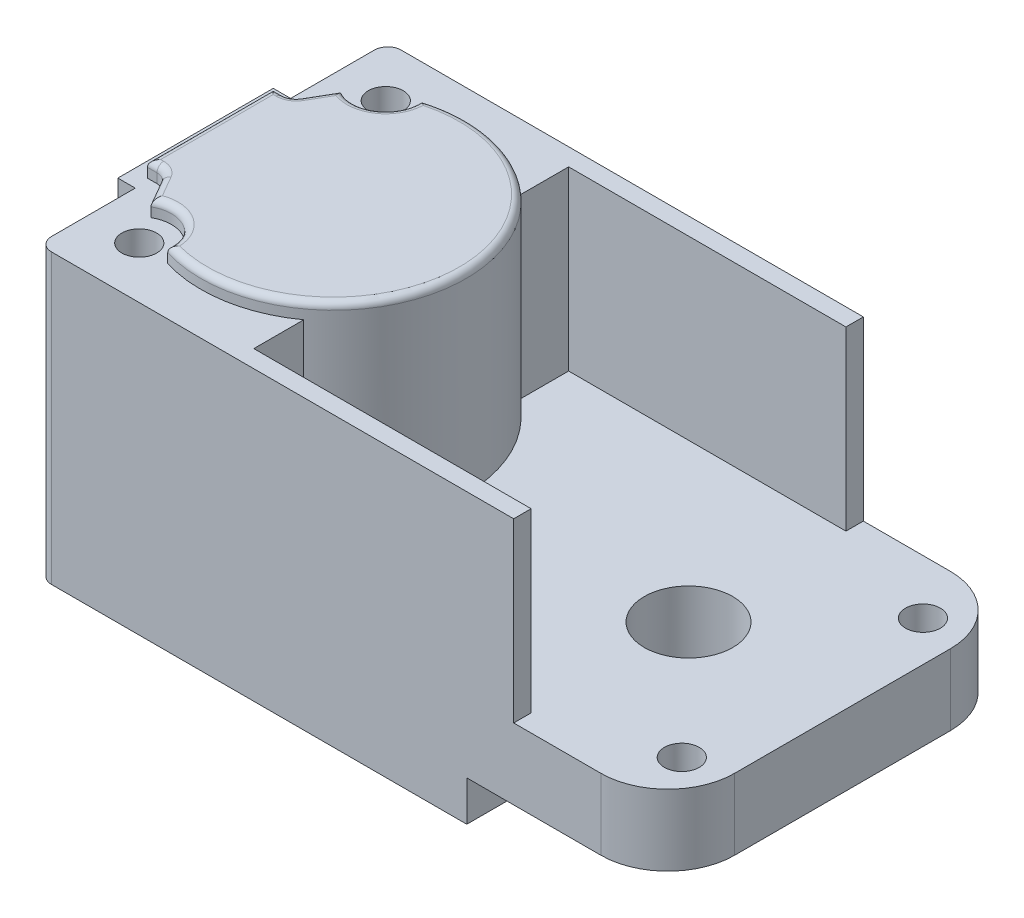
from build123d import *

# Parameters (mm, degrees)
SKETCH1_R          = 1.3
EXTRUDE1_DEPTH     = 21.5
EXTRUDE2_DEPTH     = 1.2
FILLET1_R          = 0.5
SKETCH4_W          = 11.5
SKETCH4_H          = 26.1
CUT_EXTRUDE2_DEPTH = 13.2
CUT_EXTRUDE3_DEPTH = 3
CUT_EXTRUDE4_START = -13.2
CUT_EXTRUDE4_DEPTH = 13.2
SKETCH6_R          = 3.3
CUT_EXTRUDE5_DEPTH = 46.164504919


with BuildPart() as part:
    # Sketch1 → Extrude1 (new body)
    with BuildSketch(Plane(origin=(0, 0, 0), x_dir=(1, 0, 0), z_dir=(0, 1, 0))):
        with BuildLine():
            Line((-34.5, 13.05), (6.5, 13.05))
            ThreePointArc((6.5, 13.05), (10.035533906, 11.585533906), (11.5, 8.05))
            Line((11.5, 8.05), (11.5, -8.05))
            ThreePointArc((11.5, -8.05), (10.035533906, -11.585533906), (6.5, -13.05))
            Line((6.5, -13.05), (-34.5, -13.05))
            ThreePointArc((-34.5, -13.05), (-35.207106781, -12.757106781), (-35.5, -12.05))
            Line((-35.5, -12.05), (-35.5, -5.8))
            Line((-35.5, -5.8), (-36.8, -5.8))
            Line((-36.8, -5.8), (-36.8, 5.8))
            Line((-36.8, 5.8), (-35.5, 5.8))
            Line((-35.5, 5.8), (-35.5, 12.05))
            ThreePointArc((-35.5, 12.05), (-35.207106781, 12.757106781), (-34.5, 13.05))
        make_face()
        with Locations(Location((-31.8, 9.2, 0), (0, 0, 270))):
            Circle(SKETCH1_R, mode=Mode.SUBTRACT)
        with Locations(Location((8.5, 9, 0), (0, 0, 270))):
            Circle(SKETCH1_R, mode=Mode.SUBTRACT)
        with Locations(Location((8.5, -9, 0), (0, 0, 90))):
            Circle(SKETCH1_R, mode=Mode.SUBTRACT)
        with Locations(Location((-31.8, -9.2, 0), (0, 0, 90))):
            Circle(SKETCH1_R, mode=Mode.SUBTRACT)
    extrude(amount=EXTRUDE1_DEPTH)

    # Sketch2 → Extrude2 (add)
    with BuildSketch(Plane(origin=(0, 21.5, 0), x_dir=(-1, 0, 0), z_dir=(0, 1, 0))):
        with BuildLine():
            Line((33.000666235, -7.121923824), (34.111271501, -5.199722402))
            ThreePointArc((34.111271501, -5.199722402), (34.477275392, -4.833894464), (34.977136574, -4.7))
            Line((34.977136574, -4.7), (35.7, -4.7))
            Line((35.7, -4.7), (35.7, 4.7))
            Line((35.7, 4.7), (34.977136574, 4.7))
            ThreePointArc((34.977136574, 4.7), (34.477275392, 4.833894464), (34.111271501, 5.199722402))
            Line((34.111271501, 5.199722402), (33.000666235, 7.121923824))
            ThreePointArc((33.000666235, 7.121923824), (30.488773811, 7.189854264), (29.414271687, 9.461343485))
            ThreePointArc((29.414271687, 9.461343485), (16.6, 0), (29.414271687, -9.461343485))
            ThreePointArc((29.414271687, -9.461343485), (30.488773811, -7.189854264), (33.000666235, -7.121923824))
        make_face()
    extrude(amount=EXTRUDE2_DEPTH)

    # Fillet1
    fillet1_edges = [part.edges().sort_by_distance(p)[0] for p in [
        (-30.488773811, 22.7, 7.189854264),
        (-16.6, 22.7, 0),
        (-30.488773811, 22.7, -7.189854264),
        (-33.555968868, 22.7, -6.160823113),
        (-34.477275392, 22.7, -4.833894464),
        (-35.338568287, 22.7, -4.7),
        (-35.7, 22.7, 0),
        (-35.338568287, 22.7, 4.7),
        (-34.477275392, 22.7, 4.833894464),
        (-33.555968868, 22.7, 6.160823113),
    ]]
    fillet(fillet1_edges, radius=FILLET1_R)

    # Sketch4 → Cut-Extrude2 (cut)
    with BuildSketch(Plane(origin=(0, 21.5, 0), x_dir=(-1, 0, 0), z_dir=(0, 1, 0))):
        with Locations((-5.75, 0)):
            Rectangle(SKETCH4_W, SKETCH4_H)
    extrude(amount=-CUT_EXTRUDE2_DEPTH, mode=Mode.SUBTRACT)

    # Sketch5 → Cut-Extrude3 (cut)
    with BuildSketch(Plane.XZ):
        with BuildLine():
            Line((-3.5, -13.05), (-3.5, 13.05))
            Line((-3.5, 13.05), (6.5, 13.05))
            ThreePointArc((6.5, 13.05), (10.035533906, 11.585533906), (11.5, 8.05))
            Line((11.5, 8.05), (11.5, -8.05))
            ThreePointArc((11.5, -8.05), (10.035533906, -11.585533906), (6.5, -13.05))
            Line((6.5, -13.05), (-3.5, -13.05))
        make_face()
    extrude(amount=-CUT_EXTRUDE3_DEPTH, mode=Mode.SUBTRACT)

    # Sketch3 → Cut-Extrude4 (cut)
    with BuildSketch(Plane(origin=(0, 21.5, 0), x_dir=(-1, 0, 0), z_dir=(0, 1, 0)).offset(CUT_EXTRUDE4_START)):
        with BuildLine():
            Line((20.7, 8.023091673), (20.7, 11.75))
            Line((20.7, 11.75), (-6.5, 11.75))
            ThreePointArc((-6.5, 11.75), (-7.422418806, 11.633175065), (-8.286588144, 11.290077592))
            ThreePointArc((-8.286588144, 11.290077592), (-6.441484419, 7.974079144), (-10.2, 7.450806662))
            Line((-10.2, 7.450806662), (-10.2, -7.450806662))
            ThreePointArc((-10.2, -7.450806662), (-6.441484419, -7.974079144), (-8.286588144, -11.290077592))
            ThreePointArc((-8.286588144, -11.290077592), (-7.422418806, -11.633175065), (-6.5, -11.75))
            Line((-6.5, -11.75), (20.7, -11.75))
            Line((20.7, -11.75), (20.7, -8.023091673))
            ThreePointArc((20.7, -8.023091673), (16.6, 0), (20.7, 8.023091673))
        make_face()
    extrude(amount=CUT_EXTRUDE4_DEPTH, mode=Mode.SUBTRACT)

    # Sketch6 → Cut-Extrude5 (cut, through all)
    with BuildSketch(Plane.XZ):
        with Locations(Location((0, 0, 0), (0, 0, 270))):
            Circle(SKETCH6_R)
    extrude(amount=-CUT_EXTRUDE5_DEPTH, mode=Mode.SUBTRACT)


solid = part.part
